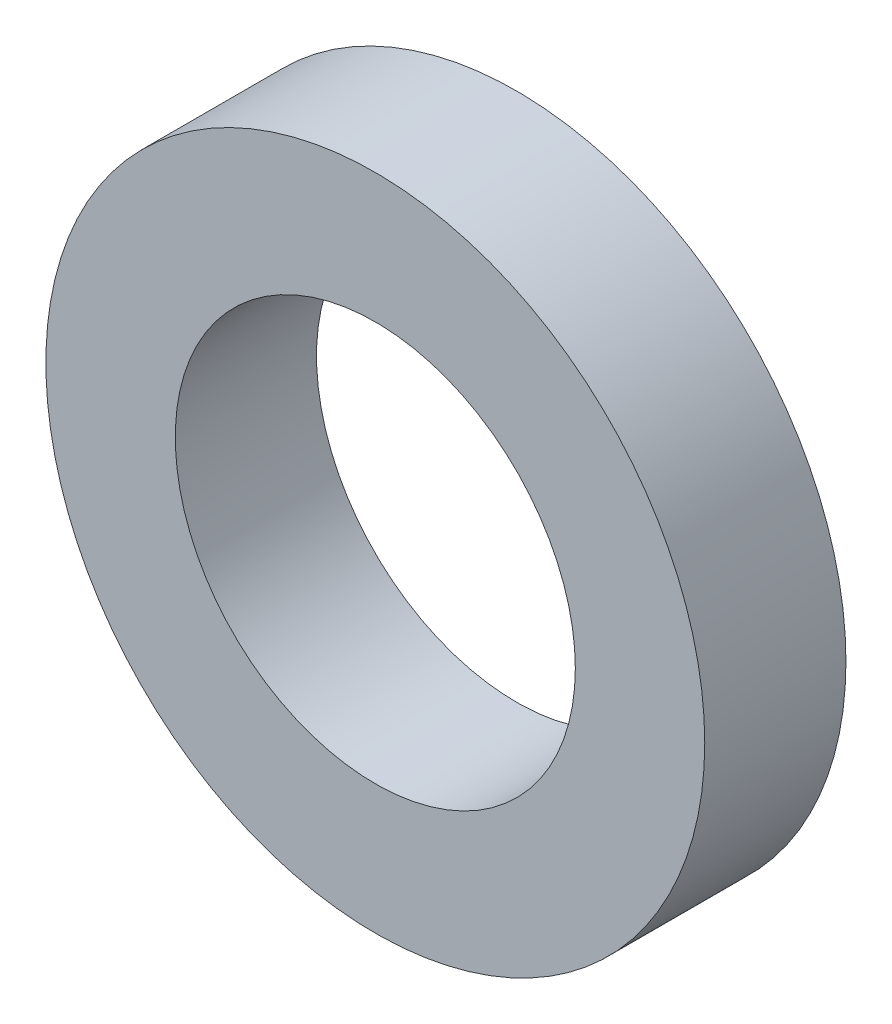
from build123d import *

# Parameters (mm, degrees)
ESQUISSE1_R        = 7
ESQUISSE1_R_2      = 4.25
BOSS_EXTRU_1_DEPTH = 3


with BuildPart() as part:
    # Esquisse1 → Boss.-Extru.1 (new body)
    with BuildSketch(Plane.XY):
        Circle(ESQUISSE1_R)
        Circle(ESQUISSE1_R_2, mode=Mode.SUBTRACT)
    extrude(amount=BOSS_EXTRU_1_DEPTH)


solid = part.part
